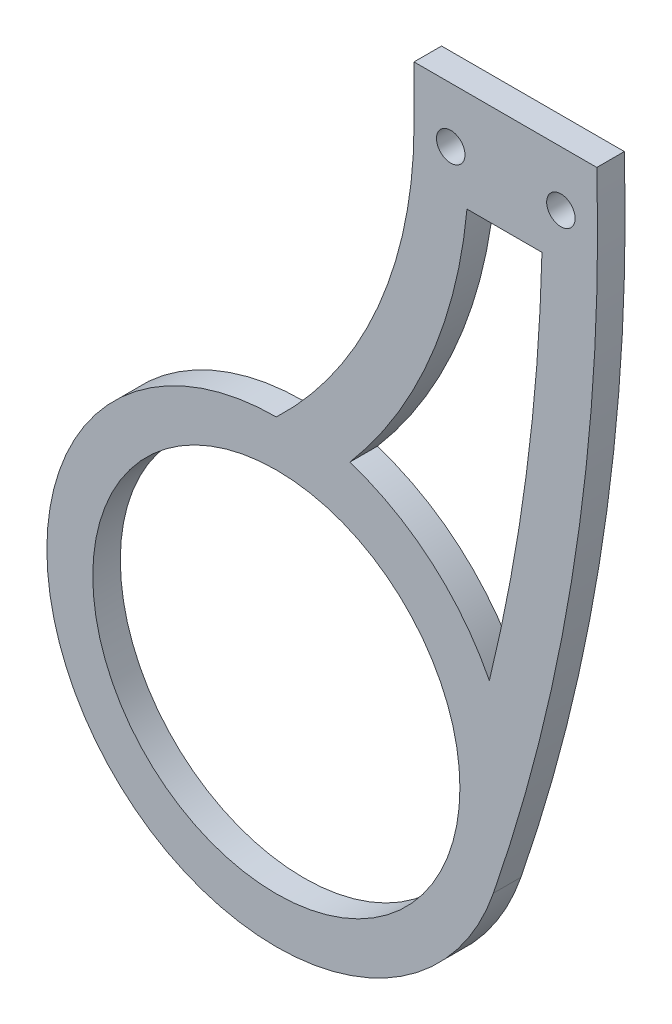
from build123d import *

# Parameters (mm, degrees)
SKETCH_1_R      = 20
SKETCH_1_R_2    = 1.55
EXTRUDE_1_DEPTH = 3


with BuildPart() as part:
    # 草图1 → 凸台-拉伸1 (new body)
    with BuildSketch(Plane.XY):
        with BuildLine():
            Line((-4, 6), (-4, 0))
            ThreePointArc((-4, 0), (-7.907990216, -19.039432765), (-19, -35))
            ThreePointArc((-19, -35), (-39.34333678, -74.530954843), (4.648648649, -68.108108108))
            ThreePointArc((4.648648649, -68.108108108), (13.142724005, -34.523787334), (16, 0))
            ThreePointArc((16, 0), (15.97856596, 3.000306232), (15.914268214, 6))
            Line((15.914268214, 6), (-4, 6))
        make_face()
        with Locations((-19, -60)):
            Circle(SKETCH_1_R, mode=Mode.SUBTRACT)
        with BuildLine():
            ThreePointArc((-10.997130101, -35.262294501), (-2.27235419, -21.118936487), (1.769449507, -5))
            Line((1.769449507, -5), (9.938716285, -5))
            ThreePointArc((9.938716285, -5), (8.233133382, -26.791038845), (4.205881516, -48.274512246))
            ThreePointArc((4.205881516, -48.274512246), (-2.093610856, -40.247177262), (-10.997130101, -35.262294501))
        make_face(mode=Mode.SUBTRACT)
        Circle(SKETCH_1_R_2, mode=Mode.SUBTRACT)
        with Locations((12, 0)):
            Circle(SKETCH_1_R_2, mode=Mode.SUBTRACT)
    extrude(amount=EXTRUDE_1_DEPTH)


solid = part.part
